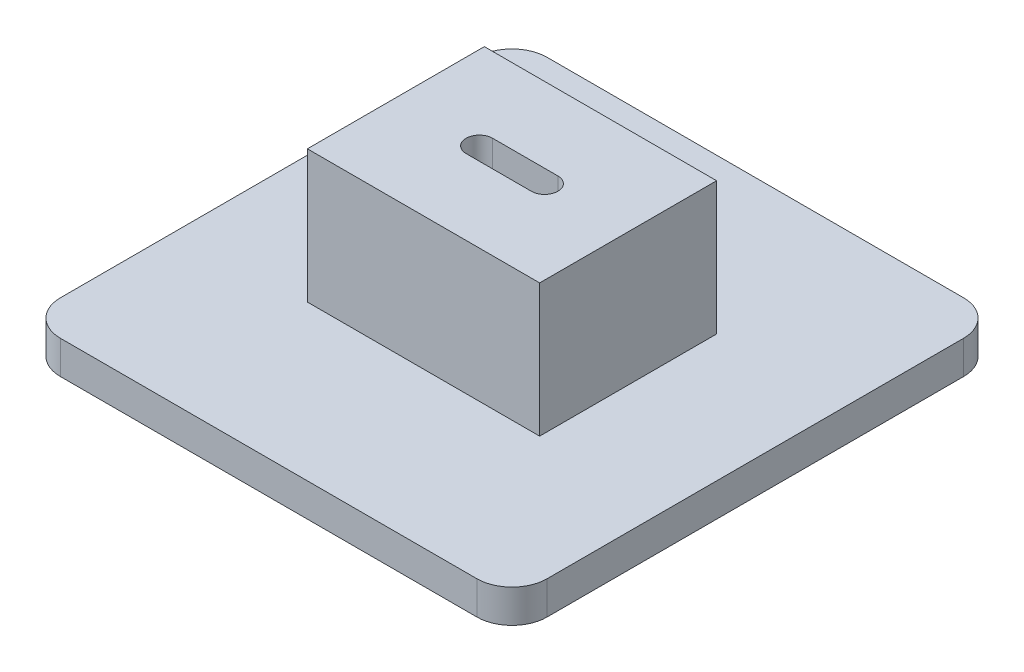
from build123d import *

# Parameters (mm, degrees)
SKETCH1_W           = 44
SKETCH1_H           = 44
BOSS_EXTRUDE1_DEPTH = 3
SKETCH2_W           = 21
SKETCH2_H           = 16
BOSS_EXTRUDE2_DEPTH = 12
SKETCH3_W           = 15
SKETCH3_H           = 10
CUT_EXTRUDE1_DEPTH  = 12
CUT_EXTRUDE2_REACH  = 66.008
FILLET1_R           = 3.175


with BuildPart() as part:
    # Sketch1 → Boss-Extrude1 (new body)
    with BuildSketch(Plane(origin=(0, 0, 0), x_dir=(1, 0, 0), z_dir=(0, 1, 0))):
        with Locations((22, 22)):
            Rectangle(SKETCH1_W, SKETCH1_H)
    extrude(amount=BOSS_EXTRUDE1_DEPTH)

    # Sketch2 → Boss-Extrude2 (add)
    with BuildSketch(Plane(origin=(0, 3, 0), x_dir=(1, 0, 0), z_dir=(0, 1, 0))):
        with Locations((22, 22)):
            Rectangle(SKETCH2_W, SKETCH2_H)
    extrude(amount=BOSS_EXTRUDE2_DEPTH)

    # Sketch3 → Cut-Extrude1 (cut)
    with BuildSketch(Plane.XZ):
        with Locations((22, -22)):
            Rectangle(SKETCH3_W, SKETCH3_H)
    extrude(amount=-CUT_EXTRUDE1_DEPTH, mode=Mode.SUBTRACT)

    # Sketch4 → Cut-Extrude2 (cut, up to next)
    with BuildSketch(Plane(origin=(0, 15, 0), x_dir=(1, 0, 0), z_dir=(0, 1, 0)), mode=Mode.PRIVATE) as cut_extrude2_sk1:
        with BuildLine():
            Line((19.05, 23.2), (24.95, 23.2))
            ThreePointArc((24.95, 23.2), (26.15, 22), (24.95, 20.8))
            Line((24.95, 20.8), (19.05, 20.8))
            ThreePointArc((19.05, 20.8), (17.85, 22), (19.05, 23.2))
        make_face()
    cut_extrude2_tool1 = extrude(cut_extrude2_sk1.sketch, amount=-CUT_EXTRUDE2_REACH, mode=Mode.PRIVATE) & part.part
    add(cut_extrude2_tool1.solids().sort_by_distance((22, 15, -22))[0], mode=Mode.SUBTRACT)

    # Fillet1
    fillet1_edges = [part.edges().sort_by_distance(p)[0] for p in [
        (0, 1.5, -44),
        (44, 1.5, -44),
        (44, 1.5, 0),
        (0, 1.5, 0),
    ]]
    fillet(fillet1_edges, radius=FILLET1_R)


solid = part.part
